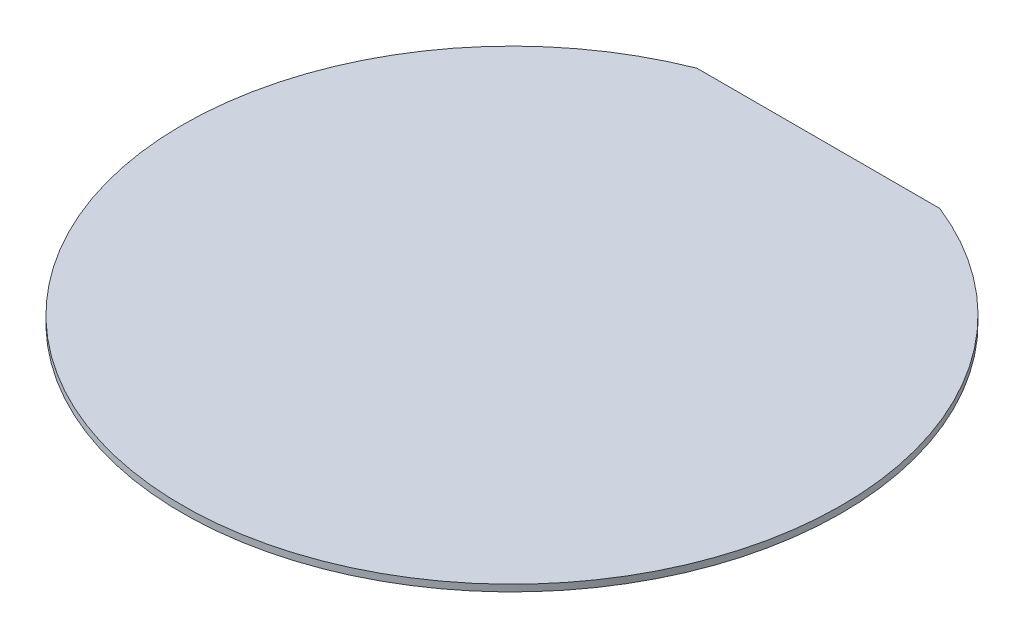
from build123d import *

# Parameters (mm, degrees)
BOSS_EXTRUDE1_DEPTH = 0.36


with BuildPart() as part:
    # Sketch1 → Boss-Extrude1 (new body)
    with BuildSketch(Plane(origin=(0, 0, 0), x_dir=(1, 0, 0), z_dir=(0, 1, 0))):
        with BuildLine():
            Line((-6.543126164, 16.5), (6.543126164, 16.5))
            ThreePointArc((6.543126164, 16.5), (0, -17.75), (-6.543126164, 16.5))
        make_face()
    extrude(amount=BOSS_EXTRUDE1_DEPTH)


solid = part.part
